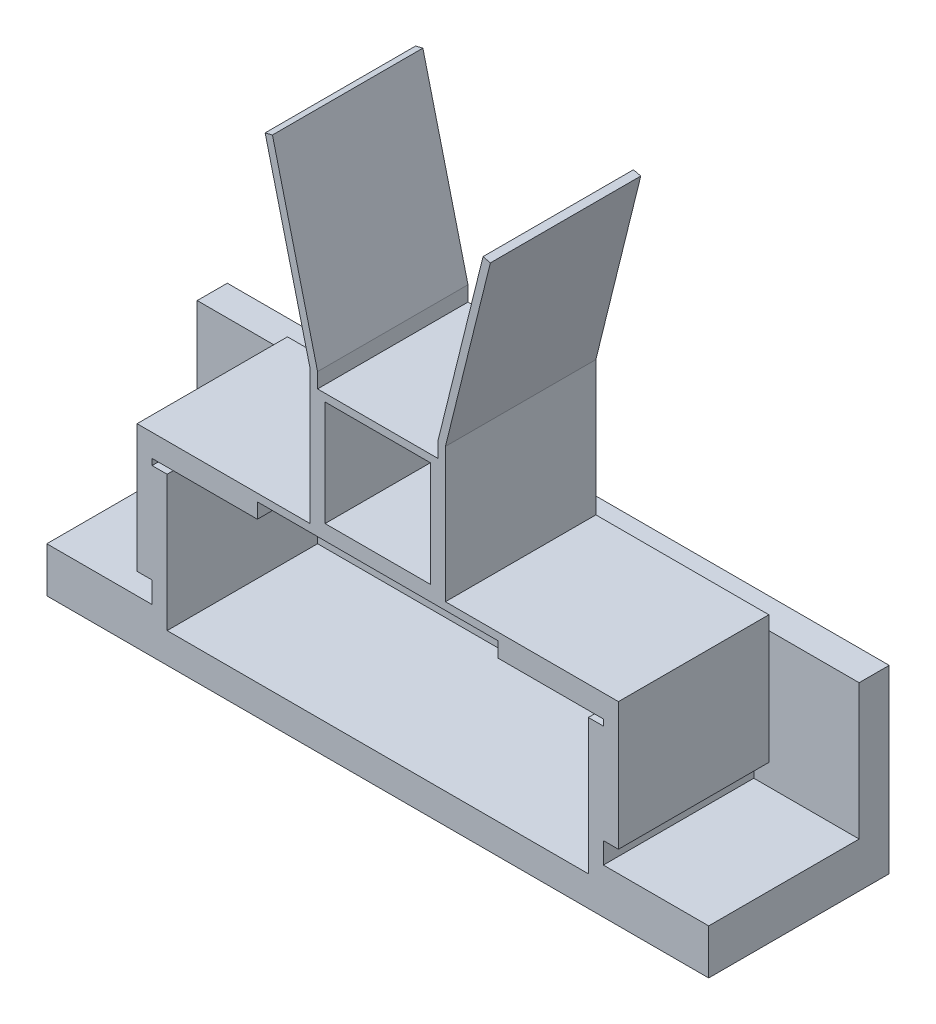
from build123d import *

# Parameters (mm, degrees)
BOSS_EXTRUDE1_DEPTH = 139.7
SKETCH2_W           = 25.4
SKETCH2_H           = 31.75
BOSS_EXTRUDE2_DEPTH = 3.175
SKETCH3_W           = 3.175
SKETCH3_H           = 31.75
BOSS_EXTRUDE3_DEPTH = 25.4
SKETCH5_W           = 22.225
SKETCH5_H           = 3.175
SKETCH5_W_2         = 25.4
SKETCH5_H_2         = 25.4
SKETCH5_H_3         = 22.225
BOSS_EXTRUDE4_DEPTH = 31.75


with BuildPart() as part:
    # Sketch1 → Boss-Extrude1 (new body)
    with BuildSketch(Plane(origin=(0, 0, 0), x_dir=(0, 0, -1), z_dir=(1, 0, 0))):
        Polygon((-31.75, 0), (0, 0), (0, 31.75), (6.35, 31.75), (6.35, -6.35), (-31.75, -6.35), align=None)
    extrude(amount=BOSS_EXTRUDE1_DEPTH)

    # Sketch2 → Boss-Extrude2 (add)
    with BuildSketch(Plane(origin=(0, 0, 0), x_dir=(1, 0, 0), z_dir=(0, 1, 0))):
        with Locations((12.7, -15.875)):
            Rectangle(SKETCH2_W, SKETCH2_H)
        with Locations((127, -15.875)):
            Rectangle(SKETCH2_W, SKETCH2_H)
    extrude(amount=BOSS_EXTRUDE2_DEPTH)

    # Sketch3 → Boss-Extrude3 (add)
    with BuildSketch(Plane(origin=(0, 3.175, 0), x_dir=(1, 0, 0), z_dir=(0, 1, 0))):
        with Locations((23.8125, -15.875)):
            Rectangle(SKETCH3_W, SKETCH3_H)
        with Locations((115.8875, -15.875)):
            Rectangle(SKETCH3_W, SKETCH3_H)
    extrude(amount=BOSS_EXTRUDE3_DEPTH)

    # Sketch5 → Boss-Extrude4 (add)
    # profile 1 of 8: a face of its own
    with BuildSketch(Plane.XY):
        Polygon((19.05, 7.657352941), (22.225, 7.657352941), (22.225, 29.882352941), (22.225, 33.057352941), (19.05, 33.057352941), align=None)
    # profile 2 of 8: a face of its own
    with BuildSketch(Plane.XY):
        with Locations((33.3375, 31.469852941)):
            Rectangle(SKETCH5_W, SKETCH5_H)
    # profile 3 of 8: a face of its own
    with BuildSketch(Plane.XY):
        Polygon((19.05, 34.644852941), (19.05, 33.057352941), (22.225, 33.057352941), (44.45, 33.057352941), (95.25, 33.057352941), (117.475, 33.057352941), (120.65, 33.057352941), (120.65, 34.644852941), (84.1375, 34.644852941), (82.55, 34.644852941), (57.15, 34.644852941), (55.5625, 34.644852941), align=None)
    # profile 4 of 8: a face of its own
    with BuildSketch(Plane.XY):
        Polygon((55.5625, 63.026302863), (55.5625, 34.644852941), (57.15, 34.644852941), (57.15, 60.044852941), (57.15, 63.219852941), (47.625, 101.701283211), (46.084004478, 101.319852941), align=None)
    # profile 5 of 8: a face of its own
    with BuildSketch(Plane.XY):
        with Locations((106.3625, 31.469852941)):
            Rectangle(SKETCH5_W, SKETCH5_H)
    # profile 6 of 8: a face of its own
    with BuildSketch(Plane.XY):
        with Locations((69.85, 47.344852941)):
            Rectangle(SKETCH5_W_2, SKETCH5_H_2)
        with Locations((69.85, 47.344852941)):
            Rectangle(SKETCH5_W, SKETCH5_H_3, mode=Mode.SUBTRACT)
    # profile 7 of 8: a face of its own
    with BuildSketch(Plane.XY):
        Polygon((120.65, 33.057352941), (117.475, 33.057352941), (117.475, 29.882352941), (117.475, 7.657352941), (120.65, 7.657352941), align=None)
    # profile 8 of 8: a face of its own
    with BuildSketch(Plane.XY):
        Polygon((82.55, 60.044852941), (82.55, 34.644852941), (84.1375, 34.644852941), (84.1375, 63.026302863), (93.615995522, 101.319852941), (92.075, 101.701283211), (82.55, 63.219852941), align=None)
    extrude(amount=BOSS_EXTRUDE4_DEPTH)


solid = part.part
